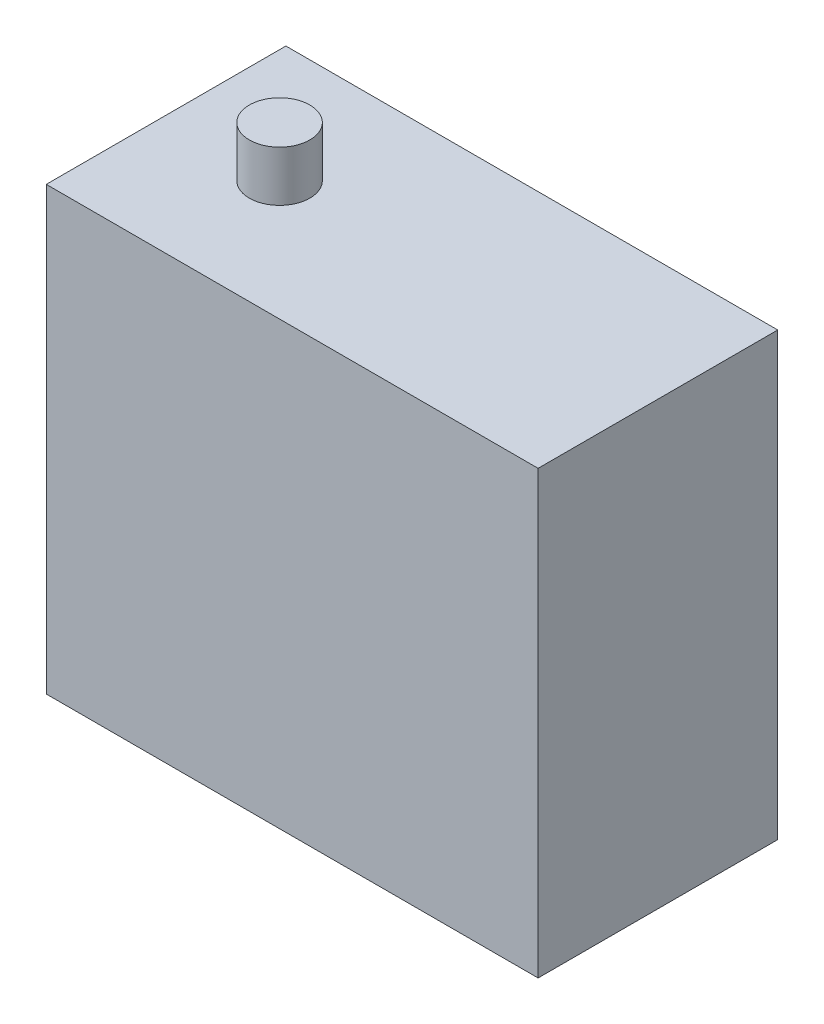
from build123d import *

# Parameters (mm, degrees)
SKETCH1_W           = 39
SKETCH1_H           = 19
BOSS_EXTRUDE1_DEPTH = 35
SKETCH2_R           = 2.4
BOSS_EXTRUDE2_DEPTH = 4


with BuildPart() as part:
    # Sketch1 → Boss-Extrude1 (new body)
    with BuildSketch(Plane(origin=(0, 0, 0), x_dir=(1, 0, 0), z_dir=(0, 1, 0))):
        Rectangle(SKETCH1_W, SKETCH1_H)
    extrude(amount=BOSS_EXTRUDE1_DEPTH)

    # Sketch2 → Boss-Extrude2 (add)
    with BuildSketch(Plane(origin=(0, 35, 0), x_dir=(1, 0, 0), z_dir=(0, 1, 0))):
        with Locations(Location((-10.5, 0, 0), (0, 0, 270))):
            Circle(SKETCH2_R)
    extrude(amount=BOSS_EXTRUDE2_DEPTH)


solid = part.part
